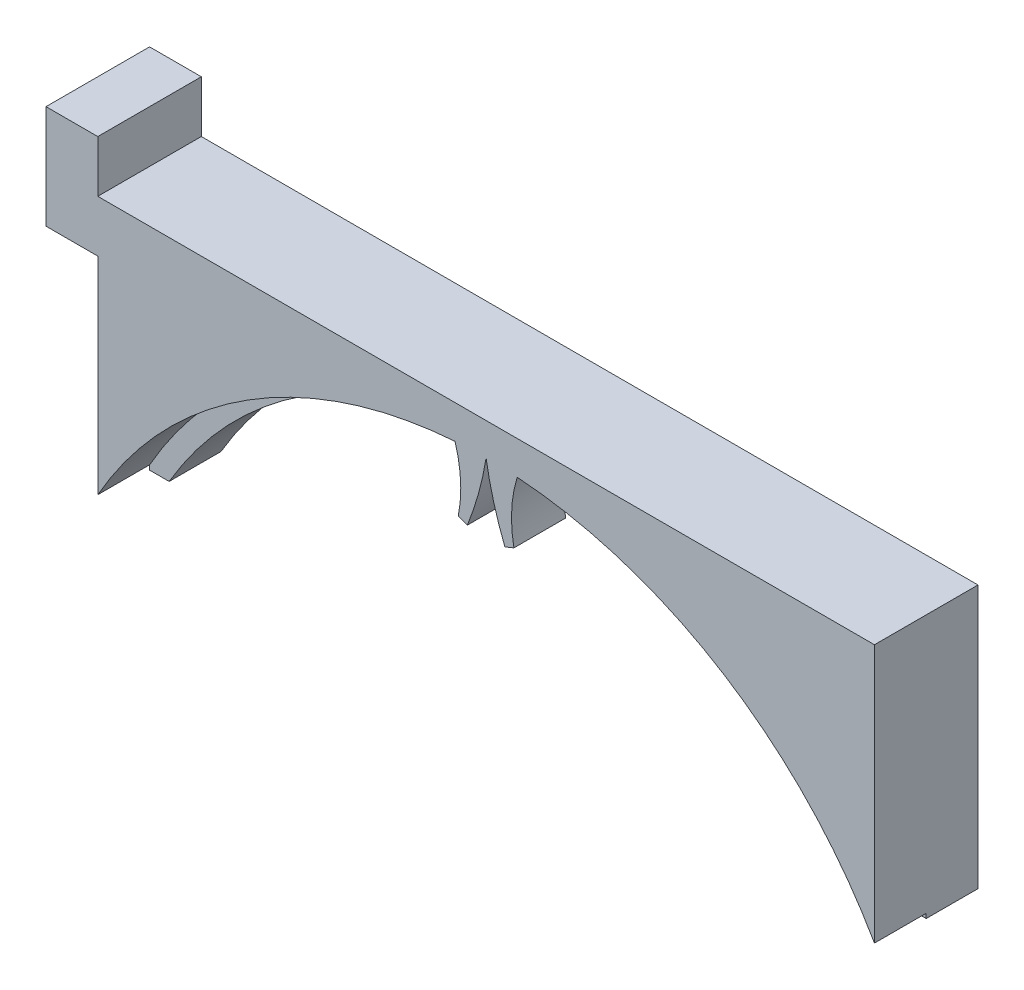
from build123d import *

# Parameters (mm, degrees)
BOSS_EXTRUDE1_DEPTH = 10
BOSS_EXTRUDE2_DEPTH = 10
SKETCH3_W           = 10
SKETCH3_H           = 20
BOSS_EXTRUDE3_DEPTH = 20


with BuildPart() as part:
    # Sketch1 → Boss-Extrude1 (new body)
    with BuildSketch(Plane.XY):
        with BuildLine():
            Line((-75, 0), (75, 0))
            Line((75, 0), (75, -50.8))
            Line((75, -50.8), (71.214043559, -50.8))
            ThreePointArc((71.214043559, -50.8), (0, -10), (-71.214043559, -50.8))
            Line((-71.214043559, -50.8), (-75, -50.8))
            Line((-75, -50.8), (-75, 0))
        make_face()
    extrude(amount=BOSS_EXTRUDE1_DEPTH)

    # Sketch2 → Boss-Extrude2 (add)
    with BuildSketch(Plane.XY.offset(10)):
        with BuildLine():
            Line((75, 0), (75, -49.913046695))
            ThreePointArc((75, -49.913046695), (45.953391498, -19.534963213), (6, -6.486594379))
            ThreePointArc((6, -6.486594379), (4.927947794, -12.515421427), (5.368573056, -18.622949642))
            Line((5.368573056, -18.622949642), (3.627612554, -19.318821125))
            ThreePointArc((3.627612554, -19.318821125), (1.458266232, -12.897160035), (0, -6.277699769))
            ThreePointArc((0, -6.277699769), (-1.458266232, -12.897160035), (-3.627612554, -19.318821125))
            Line((-3.627612554, -19.318821125), (-5.368573056, -18.622949642))
            ThreePointArc((-5.368573056, -18.622949642), (-4.927947794, -12.515421427), (-6, -6.486594379))
            ThreePointArc((-6, -6.486594379), (-45.953391498, -19.534963213), (-75, -49.913046695))
            Line((-75, -49.913046695), (-75, 0))
            Line((-75, 0), (75, 0))
        make_face()
    extrude(amount=BOSS_EXTRUDE2_DEPTH)

    # Sketch3 → Boss-Extrude3 (add)
    with BuildSketch(Plane.XY.offset(20)):
        with Locations((-80, 0)):
            Rectangle(SKETCH3_W, SKETCH3_H)
    extrude(amount=-BOSS_EXTRUDE3_DEPTH)


solid = part.part
